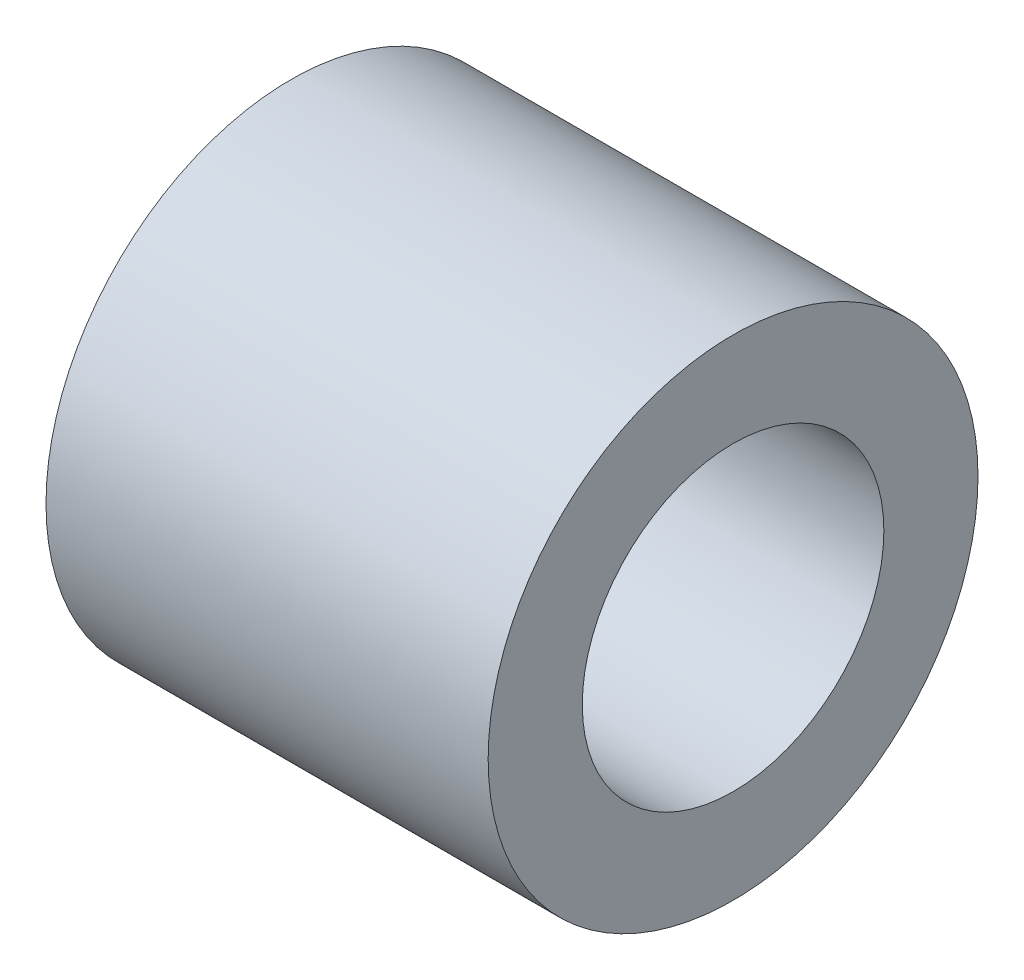
from build123d import *

# Parameters (mm, degrees)
SKETCH1_R           = 4.93
SKETCH1_R_2         = 3.035
BOSS_EXTRUDE1_DEPTH = 4.45


with BuildPart() as part:
    # Sketch1 → Boss-Extrude1 (new, symmetric)
    with BuildSketch(Plane(origin=(0, 0, 0), x_dir=(0, 0, -1), z_dir=(1, 0, 0))):
        Circle(SKETCH1_R)
        Circle(SKETCH1_R_2, mode=Mode.SUBTRACT)
    extrude(amount=BOSS_EXTRUDE1_DEPTH, both=True)


solid = part.part
